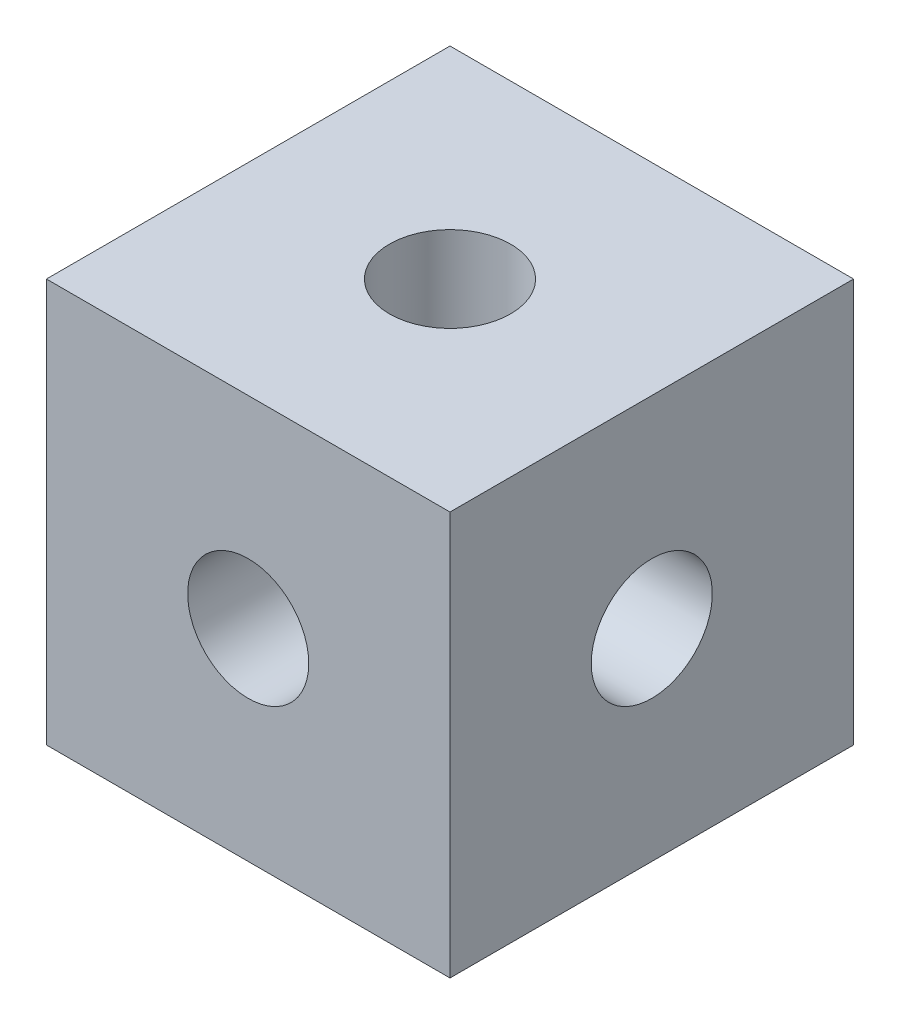
from build123d import *

# Parameters (mm, degrees)
SKETCH_1_W          = 10
SKETCH_1_H          = 10
EXTRUDE_1_DEPTH     = 10
SKETCH_2_R          = 1.5
CUT_EXTRUDE_1_DEPTH = 18.320508076
SKETCH_3_R          = 1.5
CUT_EXTRUDE_2_DEPTH = 18.320508076
SKETCH_4_R          = 1.5
CUT_EXTRUDE_3_DEPTH = 18.320508076


with BuildPart() as part:
    # 草图1 → 凸台-拉伸1 (new body)
    with BuildSketch(Plane.XY):
        with Locations((5, 5)):
            Rectangle(SKETCH_1_W, SKETCH_1_H)
    extrude(amount=EXTRUDE_1_DEPTH)

    # 草图2 → 切除-拉伸1 (cut, through all)
    with BuildSketch(Plane.XY.offset(10)):
        with Locations((5, 5)):
            Circle(SKETCH_2_R)
    extrude(amount=-CUT_EXTRUDE_1_DEPTH, mode=Mode.SUBTRACT)

    # 草图3 → 切除-拉伸2 (cut, through all)
    with BuildSketch(Plane.ZY):
        with Locations((5, 5)):
            Circle(SKETCH_3_R)
    extrude(amount=-CUT_EXTRUDE_2_DEPTH, mode=Mode.SUBTRACT)

    # 草图4 → 切除-拉伸3 (cut, through all)
    with BuildSketch(Plane(origin=(0, 10, 0), x_dir=(1, 0, 0), z_dir=(0, 1, 0))):
        with Locations(Location((5, -5, 0), (0, 0, 270))):
            Circle(SKETCH_4_R)
    extrude(amount=-CUT_EXTRUDE_3_DEPTH, mode=Mode.SUBTRACT)


solid = part.part
